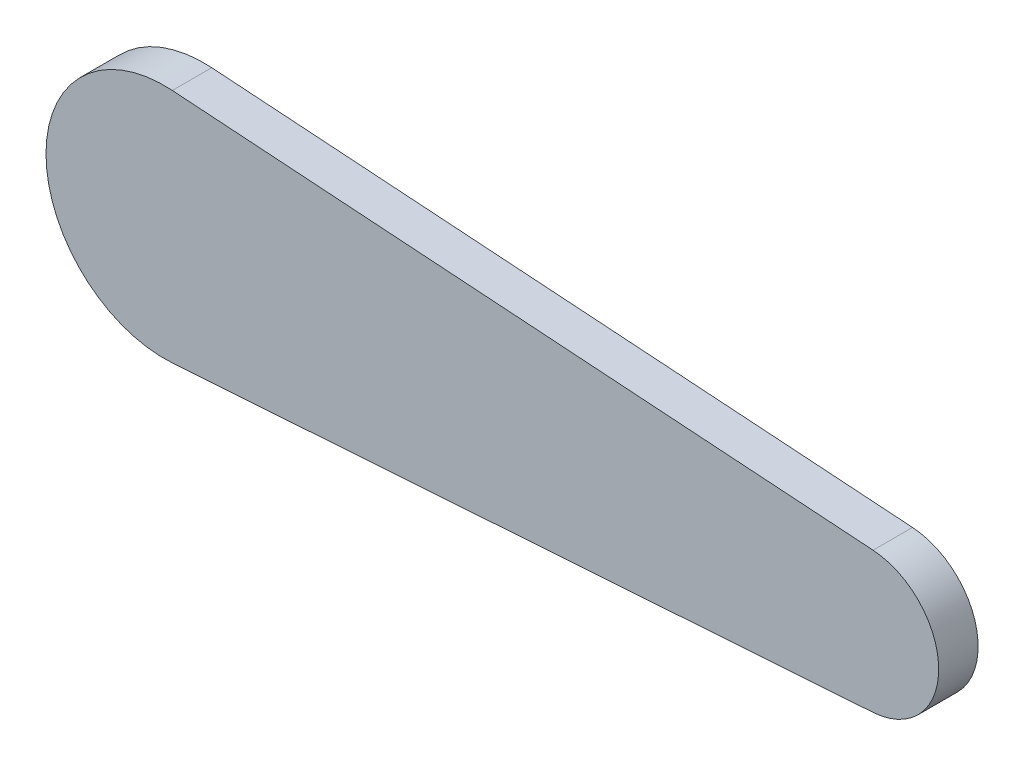
from build123d import *

# Parameters (mm, degrees)
EXTRUDE_1_DEPTH = 7


with BuildPart() as part:
    # 草图2 → 凸台-拉伸1 (new body)
    with BuildSketch(Plane.XY):
        with BuildLine():
            Line((1.428, 20.951391744), (125.85, 12.471066514))
            ThreePointArc((125.85, 12.471066514), (137.5, 0), (125.85, -12.471066514))
            Line((125.85, -12.471066514), (1.428, -20.951391744))
            ThreePointArc((1.428, -20.951391744), (-21, 0), (1.428, 20.951391744))
        make_face()
    extrude(amount=EXTRUDE_1_DEPTH)


solid = part.part
